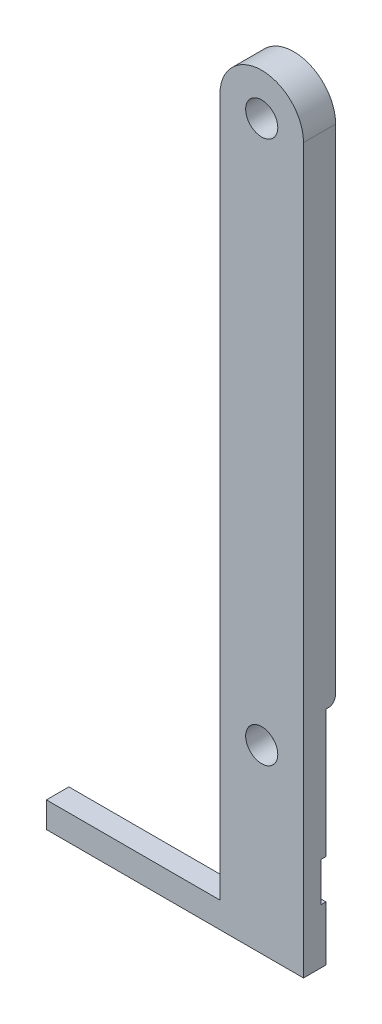
from build123d import *

# Parameters (mm, degrees)
SKETCH1_W           = 27
SKETCH1_H           = 4
SKETCH1_W_2         = 13
SKETCH1_R           = 6.5
SKETCH1_R_2         = 2.5
BOSS_EXTRUDE1_DEPTH = 5
SKETCH2_R           = 2.5
CUT_EXTRUDE1_DEPTH  = 1.5
CUT_EXTRUDE2_DEPTH  = 0.8
FILLET1_R           = 1


with BuildPart() as part:
    # Sketch1 → Boss-Extrude1 (new body)
    # profile 1 of 6: a face of its own
    with BuildSketch(Plane.XY):
        with Locations((-20, -26.12)):
            Rectangle(SKETCH1_W, SKETCH1_H)
    # profile 2 of 6: a face of its own
    with BuildSketch(Plane.XY):
        with Locations((0, -26.12)):
            Rectangle(SKETCH1_W_2, SKETCH1_H)
    # profile 3 of 6: a face of its own
    with BuildSketch(Plane.XY):
        with BuildLine():
            Line((-6.5, -24.12), (6.5, -24.12))
            Line((6.5, -24.12), (6.5, 0))
            ThreePointArc((6.5, 0), (0, -6.5), (-6.5, 0))
            Line((-6.5, 0), (-6.5, -24.12))
        make_face()
    # profile 4 of 6: a face of its own
    with BuildSketch(Plane.XY):
        Circle(SKETCH1_R)
        Circle(SKETCH1_R_2, mode=Mode.SUBTRACT)
    # profile 5 of 6: a face of its own
    with BuildSketch(Plane.XY):
        with BuildLine():
            ThreePointArc((-6.5, 0), (0, 6.5), (6.5, 0))
            Line((6.5, 0), (6.5, 84.43))
            ThreePointArc((6.5, 84.43), (0, 77.93), (-6.5, 84.43))
            Line((-6.5, 84.43), (-6.5, 0))
        make_face()
    # profile 6 of 6: a face of its own
    with BuildSketch(Plane.XY):
        with Locations((0, 84.43)):
            Circle(SKETCH1_R)
        with Locations((0, 84.43)):
            Circle(SKETCH1_R_2, mode=Mode.SUBTRACT)
    extrude(amount=BOSS_EXTRUDE1_DEPTH)

    # Sketch2 → Cut-Extrude1 (cut)
    with BuildSketch(Plane(origin=(0, 0, 0), x_dir=(-1, 0, 0), z_dir=(0, 0, -1))):
        with BuildLine():
            Line((33.5, -28.12), (33.5, -24.12))
            Line((33.5, -24.12), (6.5, -24.12))
            Line((6.5, -24.12), (6.5, 6.368673331))
            ThreePointArc((6.5, 6.368673331), (0, 9.1), (-6.5, 6.368673331))
            Line((-6.5, 6.368673331), (-6.5, -28.12))
            Line((-6.5, -28.12), (33.5, -28.12))
        make_face()
        Circle(SKETCH2_R, mode=Mode.SUBTRACT)
    extrude(amount=-CUT_EXTRUDE1_DEPTH, mode=Mode.SUBTRACT)

    # Sketch3 → Cut-Extrude2 (cut)
    with BuildSketch(Plane(origin=(0, 0, 1.5), x_dir=(-1, 0, 0), z_dir=(0, 0, -1))):
        with BuildLine():
            ThreePointArc((-0.425, -16.56), (-1.318324317, -14.403324317), (-3.475, -13.51))
            ThreePointArc((-3.475, -13.51), (-5.489184715, -14.269681259), (-6.5, -16.170288568))
            Line((-6.5, -16.170288568), (-6.5, -16.949711432))
            ThreePointArc((-6.5, -16.949711432), (-5.489184715, -18.850318741), (-3.475, -19.61))
            ThreePointArc((-3.475, -19.61), (-1.318324317, -18.716675683), (-0.425, -16.56))
        make_face()
        with BuildLine():
            Line((-6.5, -16.949711432), (-6.5, -16.170288568))
            ThreePointArc((-6.5, -16.170288568), (-6.525, -16.56), (-6.5, -16.949711432))
        make_face()
        with BuildLine():
            Line((-6.5, -19.61), (-3.475, -19.61))
            ThreePointArc((-3.475, -19.61), (-5.489184715, -18.850318741), (-6.5, -16.949711432))
            Line((-6.5, -16.949711432), (-6.5, -19.61))
        make_face()
        with BuildLine():
            ThreePointArc((-6.5, -16.170288568), (-5.489184715, -14.269681259), (-3.475, -13.51))
            Line((-3.475, -13.51), (-6.5, -13.51))
            Line((-6.5, -13.51), (-6.5, -16.170288568))
        make_face()
        with BuildLine():
            ThreePointArc((6.5, -21.509961072), (8.002523966, -20.398869023), (8.575, -18.62))
            ThreePointArc((8.575, -18.62), (8.002523966, -16.841130977), (6.5, -15.730038928))
            Line((6.5, -15.730038928), (6.5, -21.509961072))
        make_face()
        with BuildLine():
            Line((6.5, -21.509961072), (6.5, -15.730038928))
            ThreePointArc((6.5, -15.730038928), (2.475, -18.62), (6.5, -21.509961072))
        make_face()
    extrude(amount=-CUT_EXTRUDE2_DEPTH, mode=Mode.SUBTRACT)

    # Fillet1
    fillet1_edges = [part.edges().sort_by_distance(p)[0] for p in [
        (0, 9.1, 0),
    ]]
    fillet(fillet1_edges, radius=FILLET1_R)


solid = part.part
